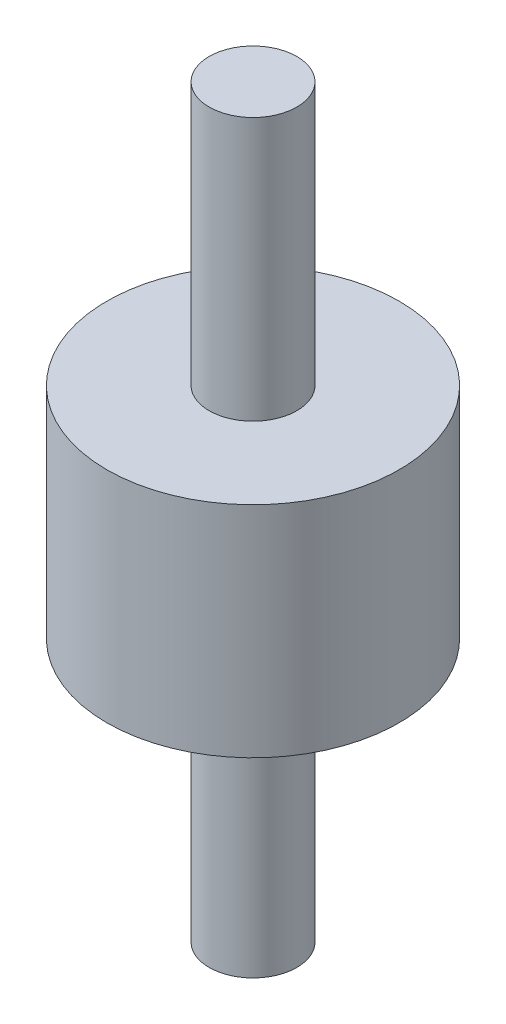
from build123d import *


with BuildPart() as part:
    # Sketch1 → Revolve1 (revolve)
    with BuildSketch(Plane.XY, mode=Mode.PRIVATE) as revolve1_sk:
        Polygon((0, 51), (-3, 51), (-3, 33), (-10, 33), (-10, 18), (-3, 18), (-3, 0), (0, 0), align=None)
    revolve(revolve1_sk.sketch.rotate(Axis((0, 0, 0), (0, 1, 0)), 270), axis=Axis((0, 0, 0), (0, 1, 0)))


solid = part.part
